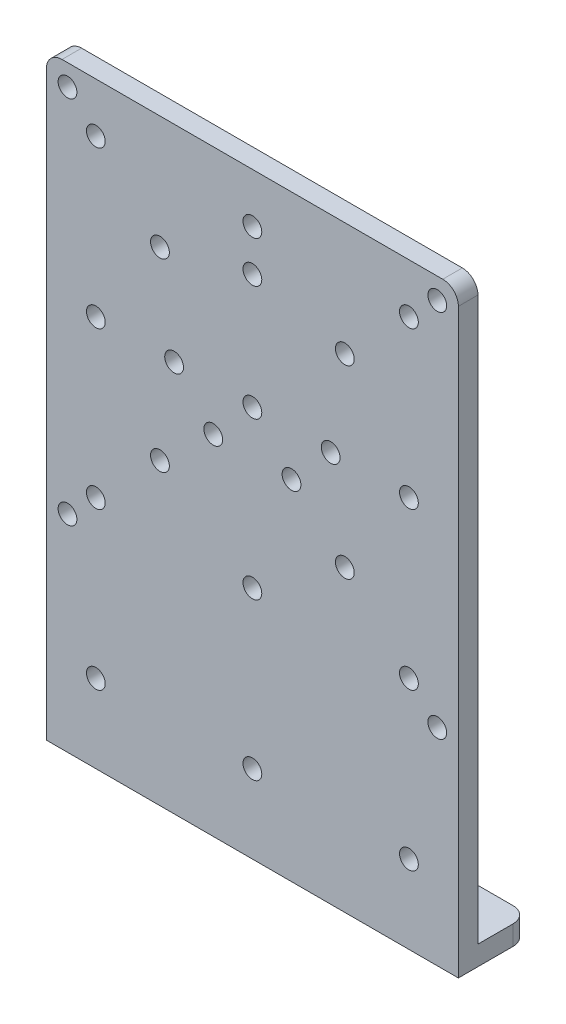
from build123d import *

# Parameters (mm, degrees)
SKETCH1_W                        = 66.8528
SKETCH1_H                        = 11.43
BOSS_EXTRUDE1_DEPTH              = 3.175
SKETCH2_W                        = 66.8528
SKETCH2_H                        = 3.175
BOSS_EXTRUDE2_DEPTH              = 93.7514
TAPPED_HOLE_FOR_4_40_HELICOIL1_D = 3.048
LPATTERN1_COUNT                  = 3
LPATTERN1_PITCH                  = 25.4
LPATTERN1_COUNT_DIR2             = 4
LPATTERN1_PITCH_DIR2             = 25.4
F_30_0_1285_DIAMETER_HOLE1_D     = 3.2639
RIB3_REACH                       = 109.949
SKETCH15_WALL_W                  = 244.822615678
SKETCH15_WALL_H                  = 2.54
RIB4_REACH                       = 109.949
SKETCH16_WALL_W                  = 244.822615678
SKETCH16_WALL_H                  = 2.54
TAPPED_HOLE_FOR_4_40_HELICOIL3_D = 3.048
FILLET1_R                        = 2.54
TAPPED_HOLE_FOR_4_40_HELICOIL4_D = 3.048


with BuildPart() as part:
    # Sketch1 → Boss-Extrude1 (new body)
    with BuildSketch(Plane(origin=(0, 0, 0), x_dir=(1, 0, 0), z_dir=(0, 1, 0))):
        with Locations((33.4264, 5.715)):
            Rectangle(SKETCH1_W, SKETCH1_H)
    extrude(amount=BOSS_EXTRUDE1_DEPTH)

    # Sketch2 → Boss-Extrude2 (add)
    with BuildSketch(Plane(origin=(0, 3.175, 0), x_dir=(1, 0, 0), z_dir=(0, 1, 0))):
        with Locations((33.4264, 1.5875)):
            Rectangle(SKETCH2_W, SKETCH2_H)
    extrude(amount=BOSS_EXTRUDE2_DEPTH)

    # Tapped Hole for #4-40 Helicoil1 (through all)
    with Locations(Plane.XY):
        with Locations((8.0264, 88.9)):
            tapped_hole_for_4_40_helicoil1 = Hole(TAPPED_HOLE_FOR_4_40_HELICOIL1_D / 2)

    # LPattern1: Tapped Hole for _4-40 Helicoil1 3 × 4
    with Locations(*[(i * LPATTERN1_PITCH, -j * LPATTERN1_PITCH_DIR2, 0) for i in range(LPATTERN1_COUNT) for j in range(LPATTERN1_COUNT_DIR2) if (i, j) != (0, 0)]):
        add(tapped_hole_for_4_40_helicoil1, mode=Mode.SUBTRACT)

    # #30 (0.1285) Diameter Hole1 (through all)
    with Locations(Plane(origin=(0, 3.175, 0), x_dir=(1, 0, 0), z_dir=(0, 1, 0))):
        with Locations((8.0264, 8.001), (33.4264, 8.001), (58.8264, 8.001)):
            Hole(F_30_0_1285_DIAMETER_HOLE1_D / 2)

    # Sketch15 wall → Rib3 (add, up to next)
    with BuildSketch(Plane(origin=(46.1264, 15.988809865, -7.3025), x_dir=(0, 0.951838472973, 0.306599937001), z_dir=(0, 0.306599937001, -0.951838472973)), mode=Mode.PRIVATE) as rib3_sk1:
        Rectangle(SKETCH15_WALL_W, SKETCH15_WALL_H)
    rib3_tool1 = extrude(rib3_sk1.sketch, amount=-RIB3_REACH, mode=Mode.PRIVATE) - part.part
    add(rib3_tool1.solids().sort_by_distance((46.1264, 15.988809865, -7.3025))[0])

    # Sketch16 wall → Rib4 (add, up to next)
    with BuildSketch(Plane(origin=(20.7264, 15.988809865, -7.3025), x_dir=(0, 0.951838472973, 0.306599937001), z_dir=(0, 0.306599937001, -0.951838472973)), mode=Mode.PRIVATE) as rib4_sk1:
        Rectangle(SKETCH16_WALL_W, SKETCH16_WALL_H)
    rib4_tool1 = extrude(rib4_sk1.sketch, amount=-RIB4_REACH, mode=Mode.PRIVATE) - part.part
    add(rib4_tool1.solids().sort_by_distance((20.7264, 15.988809865, -7.3025))[0])

    # Tapped Hole for #4-40 Helicoil3 (through all)
    with Locations(Plane.XY):
        with Locations((27.0764, 56.515), (39.7764, 56.515), (33.4264, 82.169), (20.7264, 63.5), (46.1264, 63.5)):
            Hole(TAPPED_HOLE_FOR_4_40_HELICOIL3_D / 2)

    # Fillet1
    fillet1_edges = [part.edges().sort_by_distance(p)[0] for p in [
        (21.9964, 15.988809865, -3.175),
        (19.4564, 15.988809865, -3.175),
        (66.8528, 96.9264, -1.5875),
        (0, 96.9264, -1.5875),
        (0, 1.5875, -11.43),
        (66.8528, 1.5875, -11.43),
        (47.3964, 15.988809865, -3.175),
        (44.8564, 15.988809865, -3.175),
    ]]
    fillet(fillet1_edges, radius=FILLET1_R)

    # Tapped Hole for #4-40 Helicoil4 (through all)
    with Locations(Plane.XY):
        with Locations((3.4264, 93.5), (3.4264, 33.5), (63.4264, 33.5), (63.4264, 93.5), (18.4264, 78.5), (48.4264, 78.5), (48.4264, 48.5), (18.4264, 48.5)):
            Hole(TAPPED_HOLE_FOR_4_40_HELICOIL4_D / 2)


solid = part.part
